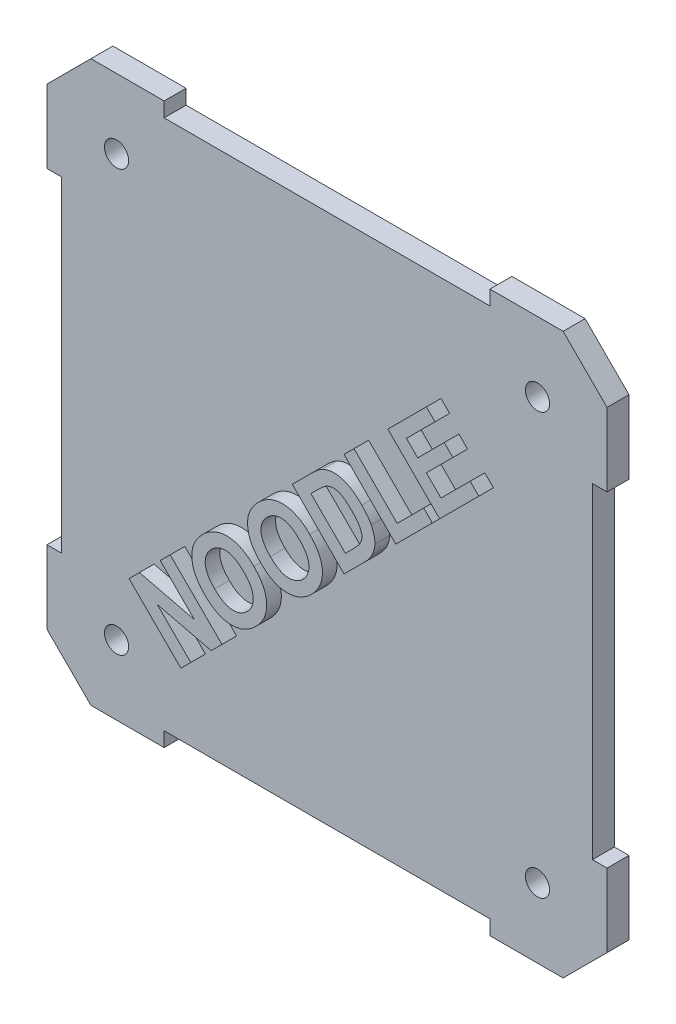
from build123d import *

# Parameters (mm, degrees)
SKETCH1_R           = 1.65
BOSS_EXTRUDE1_DEPTH = 3
CHAMFER1_SIZE       = 6
BOSS_EXTRUDE2_DEPTH = 2


with BuildPart() as part:
    # Sketch1 → Boss-Extrude1 (new body)
    with BuildSketch(Plane.XY):
        Polygon((38.25, -38.25), (22.25, -38.25), (22.25, -36.25), (-22.25, -36.25), (-22.25, -38.25), (-38.25, -38.25), (-38.25, -22.25), (-36.25, -22.25), (-36.25, 22.25), (-38.25, 22.25), (-38.25, 38.25), (-22.25, 38.25), (-22.25, 36.25), (22.25, 36.25), (22.25, 38.25), (38.25, 38.25), (38.25, 22.25), (36.25, 22.25), (36.25, -22.25), (38.25, -22.25), align=None)
        with Locations((-28.75, 28.75)):
            Circle(SKETCH1_R, mode=Mode.SUBTRACT)
        with Locations((28.75, 28.75)):
            Circle(SKETCH1_R, mode=Mode.SUBTRACT)
        with Locations((28.75, -28.75)):
            Circle(SKETCH1_R, mode=Mode.SUBTRACT)
        with Locations((-28.75, -28.75)):
            Circle(SKETCH1_R, mode=Mode.SUBTRACT)
    extrude(amount=BOSS_EXTRUDE1_DEPTH)

    # Chamfer1
    chamfer1_edges = [part.edges().sort_by_distance(p)[0] for p in [
        (-38.25, 38.25, 1.5),
        (38.25, 38.25, 1.5),
        (38.25, -38.25, 1.5),
        (-38.25, -38.25, 1.5),
    ]]
    chamfer(chamfer1_edges, length=CHAMFER1_SIZE)

    # Sketch2 → Boss-Extrude2 (add)
    # profile 1 of 6: a face of its own
    with BuildSketch(Plane(origin=(-5.748287554, 4.365374203, 3), x_dir=(0.7071067811865464, 0.7071067811865488, 0), z_dir=(0, 0, 1))):
        Polygon((-29.913555737, -12.626863483), (-29.913555737, -2.626863483), (-27.904340994, -2.626863483), (-23.887914712, -9.201382714), (-23.887914712, -2.626863483), (-21.964837789, -2.626863483), (-21.964837789, -12.626863483), (-24.036151891, -12.626863483), (-27.990478814, -6.156510919), (-27.990478814, -12.626863483), align=None)
    # profile 2 of 6: a face of its own
    with BuildSketch(Plane(origin=(-5.748287554, 4.365374203, 3), x_dir=(0.7071067811865464, 0.7071067811865488, 0), z_dir=(0, 0, 1))):
        with BuildLine():
            add(Edge.make_bspline(
                [(-20.298171122, -7.686959637), (-20.297463463, -7.563383764), (-20.296073711, -7.320696701), (-20.271992548, -6.964665669), (-20.240251699, -6.623396631), (-20.188561776, -6.298231924), (-20.127755556, -5.987649667), (-20.051703113, -5.69174205), (-19.96008685, -5.411546813), (-19.887205388, -5.232645182), (-19.851456378, -5.144892329)],
                knots=[0, 0, 0, 0, 1.141009212, 2.240794809, 3.294380675, 4.305229195, 5.280013876, 6.216333343, 7.125095522, 8, 8, 8, 8], degree=3))
            add(Edge.make_bspline(
                [(-19.851456378, -5.144892329), (-19.793020314, -5.020141485), (-19.676835488, -4.772107069), (-19.461062006, -4.4216145), (-19.216495486, -4.091071609), (-18.945149378, -3.782211238), (-18.653951234, -3.499683106), (-18.341527315, -3.257879705), (-18.018977107, -3.048634822), (-17.789570681, -2.943397082), (-17.675975609, -2.89128656)],
                knots=[0, 0, 0, 0, 1.031372299, 2.050613973, 3.077158538, 4.108712802, 5.127684358, 6.111366908, 7.06480644, 8, 8, 8, 8], degree=3))
            add(Edge.make_bspline(
                [(-17.675975609, -2.89128656), (-17.5988677, -2.859658616), (-17.443012954, -2.795730477), (-17.200796335, -2.71594481), (-16.949389332, -2.651122562), (-16.690610356, -2.593179025), (-16.421946879, -2.553225049), (-16.145569816, -2.519725014), (-15.859966647, -2.502167063), (-15.666781042, -2.499840645), (-15.568603814, -2.498658355)],
                knots=[0, 0, 0, 0, 0.92659354, 1.872881803, 2.832850937, 3.813025581, 4.820167273, 5.851730198, 6.908245912, 8, 8, 8, 8], degree=3))
            add(Edge.make_bspline(
                [(-15.568603814, -2.498658355), (-15.392809885, -2.503064932), (-15.048778749, -2.511688663), (-14.546245869, -2.573976845), (-14.070697184, -2.679156176), (-13.623742433, -2.831179295), (-13.201528111, -3.021211493), (-12.807334573, -3.256924795), (-12.440578403, -3.535768062), (-12.101967973, -3.853917457), (-11.797025027, -4.210818527), (-11.531445055, -4.603137282), (-11.308659364, -5.029035281), (-11.125182484, -5.487337451), (-10.984194327, -5.979540753), (-10.882330515, -6.504256386), (-10.821815164, -7.061870846), (-10.81466419, -7.444419064), (-10.810991635, -7.640885919)],
                knots=[0, 0, 0, 0, 1.064641025, 2.083517118, 3.061799897, 4.009540929, 4.938075217, 5.861300345, 6.78508344, 7.723570974, 8.670267188, 9.622657076, 10.586935816, 11.576069104, 12.607749008, 13.683335114, 14.81022093, 16, 16, 16, 16], degree=3))
            add(Edge.make_bspline(
                [(-10.810991635, -7.640885919), (-10.814579365, -7.836037204), (-10.821564006, -8.215960297), (-10.883208913, -8.769199132), (-10.980849602, -9.290089573), (-11.12524911, -9.777441716), (-11.303249975, -10.234974385), (-11.528328186, -10.657237999), (-11.788346113, -11.049833609), (-12.092855943, -11.40288879), (-12.425767367, -11.722864045), (-12.792058326, -11.998448336), (-13.183382329, -12.234481017), (-13.603294659, -12.425062378), (-14.049058404, -12.573954634), (-14.522128285, -12.679942191), (-15.022746928, -12.741990681), (-15.36543761, -12.750645723), (-15.540558942, -12.755068611)],
                knots=[0, 0, 0, 0, 1.18845052, 2.313691126, 3.386664782, 4.412527756, 5.405809582, 6.372003093, 7.321919452, 8.268293321, 9.206237639, 10.129603466, 11.054616372, 11.9847576, 12.932764752, 13.912672021, 14.933336461, 16, 16, 16, 16], degree=3))
            add(Edge.make_bspline(
                [(-15.540558942, -12.755068611), (-15.717680619, -12.750635517), (-16.064358626, -12.741958678), (-16.570316832, -12.680099059), (-17.048082737, -12.574076613), (-17.497316128, -12.424660626), (-17.921080858, -12.236974427), (-18.315464472, -12.00335366), (-18.680684974, -11.726024044), (-19.016378069, -11.409815178), (-19.32069961, -11.057797985), (-19.580348344, -10.667726656), (-19.805438295, -10.249587502), (-19.984375001, -9.797046716), (-20.127979354, -9.314760363), (-20.225858635, -8.799953327), (-20.287622742, -8.254042495), (-20.294590727, -7.87944231), (-20.298171122, -7.686959637)],
                knots=[0, 0, 0, 0, 1.080878253, 2.11558926, 3.1052859, 4.062802436, 5.000434901, 5.928596448, 6.853693179, 7.793554778, 8.738606028, 9.68692032, 10.647726704, 11.63151566, 12.651483354, 13.714466703, 14.825613081, 16, 16, 16, 16], degree=3))
        make_face()
        with BuildLine():
            add(Edge.make_bspline(
                [(-18.375094199, -7.620853868), (-18.373173069, -7.759180287), (-18.369452838, -8.027046766), (-18.329827448, -8.415848476), (-18.269692733, -8.779323549), (-18.1812558, -9.117059447), (-18.069532569, -9.429300498), (-17.932648449, -9.716307888), (-17.77116913, -9.978509085), (-17.58091794, -10.210368652), (-17.375081069, -10.417374554), (-17.152898531, -10.596486867), (-16.918511026, -10.750649926), (-16.667862939, -10.87236114), (-16.406170704, -10.968952304), (-16.131401156, -11.040571115), (-15.842188077, -11.079896876), (-15.644837098, -11.085536511), (-15.544565353, -11.088401945)],
                knots=[0, 0, 0, 0, 1.313550922, 2.543666373, 3.708465049, 4.810029406, 5.85539231, 6.85404609, 7.825601258, 8.772642133, 9.696587791, 10.59409323, 11.479048685, 12.35559886, 13.234601248, 14.125357077, 15.047515647, 16, 16, 16, 16], degree=3))
            add(Edge.make_bspline(
                [(-15.544565353, -11.088401945), (-15.444280098, -11.085594569), (-15.246902534, -11.080069202), (-14.958044809, -11.039939372), (-14.682730741, -10.971390296), (-14.422078133, -10.875294105), (-14.174898965, -10.751650266), (-13.941408532, -10.600943218), (-13.722952732, -10.421016023), (-13.517339913, -10.217017399), (-13.332224059, -9.983617845), (-13.172119605, -9.721461896), (-13.035302928, -9.432713798), (-12.92356793, -9.11726553), (-12.83730745, -8.77452358), (-12.779626978, -8.404306603), (-12.739681161, -8.007673164), (-12.735976102, -7.733808076), (-12.734068558, -7.592808996)],
                knots=[0, 0, 0, 0, 0.949153107, 1.868086493, 2.754172764, 3.630100905, 4.492260106, 5.365378617, 6.254840125, 7.166615376, 8.102436631, 9.067266169, 10.06813181, 11.121736829, 12.23011542, 13.408501285, 14.665770308, 16, 16, 16, 16], degree=3))
            add(Edge.make_bspline(
                [(-12.734068558, -7.592808996), (-12.736223153, -7.453171338), (-12.740395733, -7.182749744), (-12.776734588, -6.791123429), (-12.836250919, -6.42677521), (-12.918985195, -6.089799473), (-13.02832374, -5.780141919), (-13.158915835, -5.496955759), (-13.316820226, -5.241720485), (-13.497917215, -5.014568252), (-13.698309373, -4.814630492), (-13.914592104, -4.639593548), (-14.147994249, -4.493952171), (-14.396237844, -4.37141471), (-14.66190736, -4.280504615), (-14.942302976, -4.214195559), (-15.23821819, -4.17336234), (-15.4409349, -4.168043868), (-15.544565353, -4.165325022)],
                knots=[0, 0, 0, 0, 1.332337092, 2.580197383, 3.749299508, 4.852775005, 5.886662144, 6.878700295, 7.822989687, 8.743523536, 9.644687758, 10.519443927, 11.392806431, 12.264866173, 13.155606721, 14.065961015, 15.011303331, 16, 16, 16, 16], degree=3))
            add(Edge.make_bspline(
                [(-15.544565353, -4.165325022), (-15.648208904, -4.168002047), (-15.850951237, -4.17323871), (-16.147327715, -4.21474798), (-16.428606666, -4.279081196), (-16.694238634, -4.375182269), (-16.944644508, -4.496542981), (-17.178898108, -4.647054453), (-17.398845278, -4.821794344), (-17.601032891, -5.02476362), (-17.785064221, -5.253904996), (-17.943044655, -5.512258986), (-18.077757683, -5.797004042), (-18.188281913, -6.108983036), (-18.270214545, -6.449054203), (-18.333186592, -6.814932058), (-18.368549358, -7.208831108), (-18.372865696, -7.480561123), (-18.375094199, -7.620853868)],
                knots=[0, 0, 0, 0, 0.981996942, 1.920933313, 2.83127778, 3.712125466, 4.592427284, 5.463259035, 6.34592384, 7.249932058, 8.173122297, 9.125107726, 10.113123258, 11.154048744, 12.256187849, 13.424658091, 14.670364834, 16, 16, 16, 16], degree=3))
        make_face(mode=Mode.SUBTRACT)
    # profile 3 of 6: a face of its own
    with BuildSketch(Plane(origin=(-5.748287554, 4.365374203, 3), x_dir=(0.7071067811865464, 0.7071067811865488, 0), z_dir=(0, 0, 1))):
        with BuildLine():
            add(Edge.make_bspline(
                [(-9.528940353, -7.686959637), (-9.528232693, -7.563383764), (-9.526842942, -7.320696701), (-9.502761779, -6.964665669), (-9.471020929, -6.623396631), (-9.419331007, -6.298231924), (-9.358524787, -5.987649667), (-9.282472344, -5.69174205), (-9.190856081, -5.411546813), (-9.117974619, -5.232645182), (-9.082225609, -5.144892329)],
                knots=[0, 0, 0, 0, 1.141009212, 2.240794809, 3.294380675, 4.305229195, 5.280013876, 6.216333343, 7.125095522, 8, 8, 8, 8], degree=3))
            add(Edge.make_bspline(
                [(-9.082225609, -5.144892329), (-9.023789544, -5.020141485), (-8.907604719, -4.772107069), (-8.691831237, -4.4216145), (-8.447264717, -4.091071609), (-8.175918609, -3.782211238), (-7.884720465, -3.499683106), (-7.572296546, -3.257879705), (-7.249746337, -3.048634822), (-7.020339912, -2.943397082), (-6.90674484, -2.89128656)],
                knots=[0, 0, 0, 0, 1.031372299, 2.050613973, 3.077158538, 4.108712802, 5.127684358, 6.111366908, 7.06480644, 8, 8, 8, 8], degree=3))
            add(Edge.make_bspline(
                [(-6.90674484, -2.89128656), (-6.829636931, -2.859658616), (-6.673782185, -2.795730477), (-6.431565566, -2.71594481), (-6.180158562, -2.651122562), (-5.921379587, -2.593179025), (-5.65271611, -2.553225049), (-5.376339046, -2.519725014), (-5.090735877, -2.502167063), (-4.897550273, -2.499840645), (-4.799373045, -2.498658355)],
                knots=[0, 0, 0, 0, 0.92659354, 1.872881803, 2.832850937, 3.813025581, 4.820167273, 5.851730198, 6.908245912, 8, 8, 8, 8], degree=3))
            add(Edge.make_bspline(
                [(-4.799373045, -2.498658355), (-4.623579116, -2.503064932), (-4.27954798, -2.511688663), (-3.7770151, -2.573976845), (-3.301466414, -2.679156176), (-2.854511664, -2.831179295), (-2.432297342, -3.021211493), (-2.038103804, -3.256924795), (-1.671347634, -3.535768062), (-1.332737204, -3.853917457), (-1.027794258, -4.210818527), (-0.762214286, -4.603137282), (-0.539428595, -5.029035281), (-0.355951715, -5.487337451), (-0.214963558, -5.979540753), (-0.113099746, -6.504256386), (-0.052584395, -7.061870846), (-0.045433421, -7.444419064), (-0.041760865, -7.640885919)],
                knots=[0, 0, 0, 0, 1.064641025, 2.083517118, 3.061799897, 4.009540929, 4.938075217, 5.861300345, 6.78508344, 7.723570974, 8.670267188, 9.622657076, 10.586935816, 11.576069104, 12.607749008, 13.683335114, 14.81022093, 16, 16, 16, 16], degree=3))
            add(Edge.make_bspline(
                [(-0.041760865, -7.640885919), (-0.045348596, -7.836037204), (-0.052333237, -8.215960297), (-0.113978144, -8.769199132), (-0.211618832, -9.290089573), (-0.356018341, -9.777441716), (-0.534019205, -10.234974385), (-0.759097417, -10.657237999), (-1.019115344, -11.049833609), (-1.323625174, -11.40288879), (-1.656536598, -11.722864045), (-2.022827556, -11.998448336), (-2.414151559, -12.234481017), (-2.834063889, -12.425062378), (-3.279827635, -12.573954634), (-3.752897516, -12.679942191), (-4.253516158, -12.741990681), (-4.596206841, -12.750645723), (-4.771328173, -12.755068611)],
                knots=[0, 0, 0, 0, 1.18845052, 2.313691126, 3.386664782, 4.412527756, 5.405809582, 6.372003093, 7.321919452, 8.268293321, 9.206237639, 10.129603466, 11.054616372, 11.9847576, 12.932764752, 13.912672021, 14.933336461, 16, 16, 16, 16], degree=3))
            add(Edge.make_bspline(
                [(-4.771328173, -12.755068611), (-4.94844985, -12.750635517), (-5.295127856, -12.741958678), (-5.801086063, -12.680099059), (-6.278851968, -12.574076613), (-6.728085359, -12.424660626), (-7.151850089, -12.236974427), (-7.546233703, -12.00335366), (-7.911454205, -11.726024044), (-8.2471473, -11.409815178), (-8.55146884, -11.057797985), (-8.811117575, -10.667726656), (-9.036207526, -10.249587502), (-9.215144232, -9.797046716), (-9.358748584, -9.314760363), (-9.456627866, -8.799953327), (-9.518391973, -8.254042495), (-9.525359958, -7.87944231), (-9.528940353, -7.686959637)],
                knots=[0, 0, 0, 0, 1.080878253, 2.11558926, 3.1052859, 4.062802436, 5.000434901, 5.928596448, 6.853693179, 7.793554778, 8.738606028, 9.68692032, 10.647726704, 11.63151566, 12.651483354, 13.714466703, 14.825613081, 16, 16, 16, 16], degree=3))
        make_face()
        with BuildLine():
            add(Edge.make_bspline(
                [(-7.60586343, -7.620853868), (-7.6039423, -7.759180287), (-7.600222068, -8.027046766), (-7.560596679, -8.415848476), (-7.500461964, -8.779323549), (-7.412025031, -9.117059447), (-7.3003018, -9.429300498), (-7.16341768, -9.716307888), (-7.001938361, -9.978509085), (-6.811687171, -10.210368652), (-6.6058503, -10.417374554), (-6.383667762, -10.596486867), (-6.149280256, -10.750649926), (-5.898632169, -10.87236114), (-5.636939935, -10.968952304), (-5.362170387, -11.040571115), (-5.072957307, -11.079896876), (-4.875606329, -11.085536511), (-4.775334583, -11.088401945)],
                knots=[0, 0, 0, 0, 1.313550922, 2.543666373, 3.708465049, 4.810029406, 5.85539231, 6.85404609, 7.825601258, 8.772642133, 9.696587791, 10.59409323, 11.479048685, 12.35559886, 13.234601248, 14.125357077, 15.047515647, 16, 16, 16, 16], degree=3))
            add(Edge.make_bspline(
                [(-4.775334583, -11.088401945), (-4.675049329, -11.085594569), (-4.477671765, -11.080069202), (-4.18881404, -11.039939372), (-3.913499972, -10.971390296), (-3.652847363, -10.875294105), (-3.405668195, -10.751650266), (-3.172177763, -10.600943218), (-2.953721963, -10.421016023), (-2.748109143, -10.217017399), (-2.56299329, -9.983617845), (-2.402888836, -9.721461896), (-2.266072158, -9.432713798), (-2.154337161, -9.11726553), (-2.068076681, -8.77452358), (-2.010396209, -8.404306603), (-1.970450391, -8.007673164), (-1.966745333, -7.733808076), (-1.964837789, -7.592808996)],
                knots=[0, 0, 0, 0, 0.949153107, 1.868086493, 2.754172764, 3.630100905, 4.492260106, 5.365378617, 6.254840125, 7.166615376, 8.102436631, 9.067266169, 10.06813181, 11.121736829, 12.23011542, 13.408501285, 14.665770308, 16, 16, 16, 16], degree=3))
            add(Edge.make_bspline(
                [(-1.964837789, -7.592808996), (-1.966992384, -7.453171338), (-1.971164964, -7.182749744), (-2.007503819, -6.791123429), (-2.06702015, -6.42677521), (-2.149754426, -6.089799473), (-2.259092971, -5.780141919), (-2.389685065, -5.496955759), (-2.547589457, -5.241720485), (-2.728686446, -5.014568252), (-2.929078603, -4.814630492), (-3.145361334, -4.639593548), (-3.37876348, -4.493952171), (-3.627007074, -4.37141471), (-3.892676591, -4.280504615), (-4.173072206, -4.214195559), (-4.46898742, -4.17336234), (-4.67170413, -4.168043868), (-4.775334583, -4.165325022)],
                knots=[0, 0, 0, 0, 1.332337092, 2.580197383, 3.749299508, 4.852775005, 5.886662144, 6.878700295, 7.822989687, 8.743523536, 9.644687758, 10.519443927, 11.392806431, 12.264866173, 13.155606721, 14.065961015, 15.011303331, 16, 16, 16, 16], degree=3))
            add(Edge.make_bspline(
                [(-4.775334583, -4.165325022), (-4.878978135, -4.168002047), (-5.081720467, -4.17323871), (-5.378096946, -4.21474798), (-5.659375897, -4.279081196), (-5.925007864, -4.375182269), (-6.175413739, -4.496542981), (-6.409667339, -4.647054453), (-6.629614509, -4.821794344), (-6.831802121, -5.02476362), (-7.015833452, -5.253904996), (-7.173813886, -5.512258986), (-7.308526914, -5.797004042), (-7.419051144, -6.108983036), (-7.500983775, -6.449054203), (-7.563955823, -6.814932058), (-7.599318589, -7.208831108), (-7.603634927, -7.480561123), (-7.60586343, -7.620853868)],
                knots=[0, 0, 0, 0, 0.981996942, 1.920933313, 2.83127778, 3.712125466, 4.592427284, 5.463259035, 6.34592384, 7.249932058, 8.173122297, 9.125107726, 10.113123258, 11.154048744, 12.256187849, 13.424658091, 14.670364834, 16, 16, 16, 16], degree=3))
        make_face(mode=Mode.SUBTRACT)
    # profile 4 of 6: a face of its own
    with BuildSketch(Plane(origin=(-5.748287554, 4.365374203, 3), x_dir=(0.7071067811865464, 0.7071067811865488, 0), z_dir=(0, 0, 1))):
        with BuildLine():
            Line((1.624905801, -2.626863483), (5.292774391, -2.626863483))
            add(Edge.make_bspline(
                [(5.292774391, -2.626863483), (5.392949837, -2.626811551), (5.5880147, -2.626710427), (5.871104885, -2.638454559), (6.135830604, -2.65026761), (6.381432027, -2.673914754), (6.608761221, -2.698701155), (6.818226122, -2.730082604), (7.008503527, -2.770301365), (7.128492351, -2.802018669), (7.185803237, -2.81716797)],
                knots=[0, 0, 0, 0, 1.259756885, 2.453039283, 3.563158368, 4.591894114, 5.55549294, 6.43918076, 7.254497783, 8, 8, 8, 8], degree=3))
            add(Edge.make_bspline(
                [(7.185803237, -2.81716797), (7.257474002, -2.840526591), (7.399524573, -2.886823089), (7.607775079, -2.96794226), (7.80508159, -3.068546393), (7.998763944, -3.174300052), (8.180175606, -3.299341453), (8.358917239, -3.429430294), (8.523388795, -3.580124606), (8.739072091, -3.79072983), (8.985183125, -4.084109569), (9.243021936, -4.47326305), (9.461256829, -4.900412534), (9.610364941, -5.2831236), (9.711048528, -5.608460334), (9.77686429, -5.8692979), (9.832770776, -6.144057009), (9.878670175, -6.432806927), (9.914332686, -6.735547693), (9.940883805, -7.052198616), (9.953816878, -7.383033238), (9.956745139, -7.608158584), (9.958239135, -7.723017329)],
                knots=[0, 0, 0, 0, 0.745524535, 1.477620414, 2.207090574, 2.934465325, 3.657932502, 4.384347339, 5.118673636, 5.861150177, 7.365375624, 8.894729774, 10.468936425, 12.099947606, 12.950091786, 13.83580991, 14.759228729, 15.722225242, 16.726454549, 17.773376212, 18.863978586, 20, 20, 20, 20], degree=3))
            add(Edge.make_bspline(
                [(9.958239135, -7.723017329), (9.955511906, -7.921528495), (9.950237501, -8.305445105), (9.889133186, -8.859435169), (9.801074148, -9.373991411), (9.701813346, -9.694993966), (9.653751955, -9.850421176)],
                knots=[0, 0, 0, 0, 1.103207939, 2.133582005, 3.096293362, 4, 4, 4, 4], degree=3))
            add(Edge.make_bspline(
                [(9.653751955, -9.850421176), (9.622015512, -9.939608696), (9.559584978, -10.115054464), (9.450336224, -10.368135844), (9.332292175, -10.60898021), (9.2044737, -10.837397803), (9.066235026, -11.052361198), (8.91705909, -11.253227424), (8.759258236, -11.442640948), (8.644940646, -11.559225869), (8.588046827, -11.617248099)],
                knots=[0, 0, 0, 0, 1.090884612, 2.145940218, 3.175104604, 4.181306866, 5.161203701, 6.118658341, 7.063689906, 8, 8, 8, 8], degree=3))
            add(Edge.make_bspline(
                [(8.588046827, -11.617248099), (8.495978881, -11.700045526), (8.306121653, -11.870785623), (7.971560703, -12.082083317), (7.593412752, -12.268791768), (7.319883645, -12.364700801), (7.177790417, -12.41452374)],
                knots=[0, 0, 0, 0, 0.908140292, 1.872714733, 2.8949153, 4, 4, 4, 4], degree=3))
            add(Edge.make_bspline(
                [(7.177790417, -12.41452374), (7.120590681, -12.432091482), (7.001875589, -12.468552422), (6.813641105, -12.50749346), (6.612696071, -12.548518229), (6.396723312, -12.573232183), (6.16796473, -12.59929414), (5.92459733, -12.613926473), (5.667464738, -12.624314579), (5.491103798, -12.626001251), (5.400947468, -12.626863483)],
                knots=[0, 0, 0, 0, 0.799129865, 1.658552685, 2.566799617, 3.538529252, 4.561352959, 5.643373779, 6.795284424, 8, 8, 8, 8], degree=3))
            Line((5.400947468, -12.626863483), (1.624905801, -12.626863483))
            Line((1.624905801, -12.626863483), (1.624905801, -2.626863483))
        make_face()
        with BuildLine():
            Line((3.547982724, -4.29353015), (3.547982724, -10.960196817))
            Line((3.547982724, -10.960196817), (5.130514776, -10.960196817))
            add(Edge.make_bspline(
                [(5.130514776, -10.960196817), (5.201961949, -10.959630192), (5.339525052, -10.958539222), (5.538582384, -10.955333541), (5.721514398, -10.946655154), (5.889279404, -10.937665759), (6.041440643, -10.922813707), (6.178660195, -10.908206146), (6.300174227, -10.887770476), (6.375224279, -10.871638827), (6.410562853, -10.86404297)],
                knots=[0, 0, 0, 0, 1.333384787, 2.567275092, 3.714769766, 4.750907381, 5.701951617, 6.567520054, 7.325492842, 8, 8, 8, 8], degree=3))
            add(Edge.make_bspline(
                [(6.410562853, -10.86404297), (6.493329797, -10.841956644), (6.654537974, -10.798938305), (6.880890552, -10.703038047), (7.085710473, -10.587344877), (7.272427844, -10.448228815), (7.440698845, -10.272418287), (7.584338715, -10.047570409), (7.717273628, -9.779407593), (7.808307488, -9.522708715), (7.873651419, -9.293431281), (7.917883898, -9.100993072), (7.952839631, -8.892794389), (7.982906121, -8.669656917), (8.007200559, -8.4318676), (8.022317708, -8.178567742), (8.032635256, -7.910067405), (8.034303936, -7.725698757), (8.035162211, -7.630869894)],
                knots=[0, 0, 0, 0, 1.038686998, 2.023088296, 2.974059649, 3.888265163, 4.839857954, 5.909819677, 7.113156087, 8.466843969, 9.20827164, 10.006482943, 10.861893492, 11.769681931, 12.739021491, 13.762258324, 14.849031541, 16, 16, 16, 16], degree=3))
            add(Edge.make_bspline(
                [(8.035162211, -7.630869894), (8.034310537, -7.536040739), (8.032660682, -7.352338801), (8.022358959, -7.085840529), (8.007326724, -6.836529438), (7.982859269, -6.604097339), (7.953258859, -6.388222998), (7.917893679, -6.188723731), (7.873927839, -6.006908792), (7.808528329, -5.790909287), (7.709386041, -5.548119135), (7.574472735, -5.282665512), (7.408794553, -5.056411913), (7.225736293, -4.859861715), (7.014667028, -4.698110833), (6.781013861, -4.562635049), (6.519689496, -4.457484067), (6.333801265, -4.412696814), (6.238287211, -4.389683996)],
                knots=[0, 0, 0, 0, 1.117996097, 2.165769068, 3.143980016, 4.062055362, 4.920439205, 5.712587309, 6.449616741, 7.124491204, 8.371470382, 9.537068822, 10.625202851, 11.666538334, 12.693249444, 13.747832046, 14.842779399, 16, 16, 16, 16], degree=3))
            add(Edge.make_bspline(
                [(6.238287211, -4.389683996), (6.196944076, -4.382001863), (6.105922316, -4.365088745), (5.954880466, -4.345334126), (5.777674721, -4.330674511), (5.573401719, -4.315708331), (5.342888581, -4.307166107), (5.085170785, -4.298250908), (4.801326756, -4.295205492), (4.603003381, -4.294104645), (4.49950516, -4.29353015)],
                knots=[0, 0, 0, 0, 0.578738571, 1.274160813, 2.095454135, 3.025967819, 4.093109015, 5.270126069, 6.575371698, 8, 8, 8, 8], degree=3))
            Line((4.49950516, -4.29353015), (3.547982724, -4.29353015))
        make_face(mode=Mode.SUBTRACT)
    # profile 5 of 6: a face of its own
    with BuildSketch(Plane(origin=(-5.748287554, 4.365374203, 3), x_dir=(0.7071067811865464, 0.7071067811865488, 0), z_dir=(0, 0, 1))):
        Polygon((11.624905801, -12.626863483), (11.624905801, -2.626863483), (13.547982724, -2.626863483), (13.547982724, -10.960196817), (18.676187853, -10.960196817), (18.676187853, -12.626863483), align=None)
    # profile 6 of 6: a face of its own
    with BuildSketch(Plane(origin=(-5.748287554, 4.365374203, 3), x_dir=(0.7071067811865464, 0.7071067811865488, 0), z_dir=(0, 0, 1))):
        Polygon((20.086444263, -12.626863483), (20.086444263, -2.626863483), (27.522341699, -2.626863483), (27.522341699, -4.29353015), (22.009521186, -4.29353015), (22.009521186, -6.473017329), (27.137726314, -6.473017329), (27.137726314, -8.139683996), (22.009521186, -8.139683996), (22.009521186, -10.960196817), (27.650546827, -10.960196817), (27.650546827, -12.626863483), align=None)
    extrude(amount=BOSS_EXTRUDE2_DEPTH)


solid = part.part
